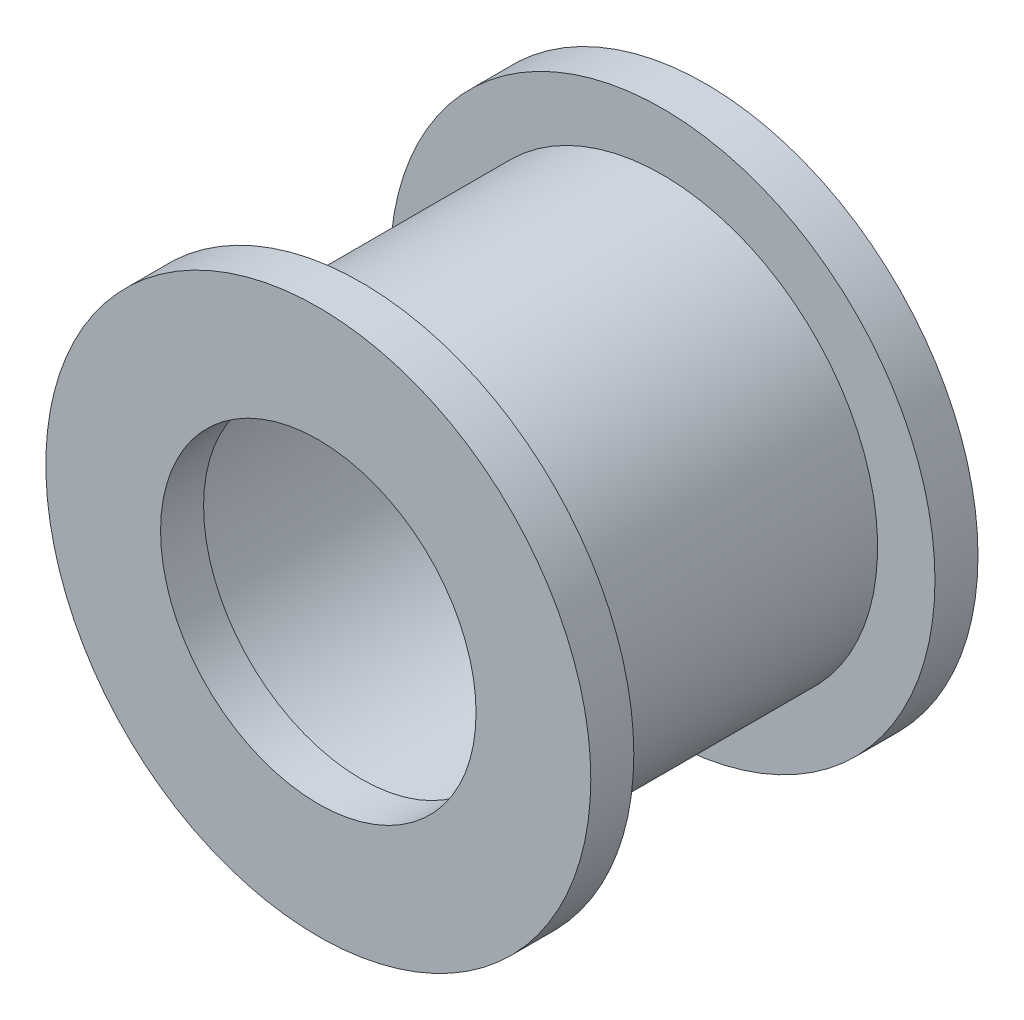
from build123d import *

# Parameters (mm, degrees)
ESQUISSE1_R        = 9.5
ESQUISSE1_R_2      = 6.45
ESQUISSE1_R_3      = 5.5
BOSS_EXTRU_1_DEPTH = 1.5
ESQUISSE1_3_R      = 6.45
ESQUISSE1_3_R_2    = 5.5
BOSS_EXTRU_4_DEPTH = 1.5
ESQUISSE6_R        = 7.5
ESQUISSE6_R_2      = 6.5
BOSS_EXTRU_5_DEPTH = 10.5
ESQUISSE7_R        = 9.5
ESQUISSE7_R_2      = 7.5
ESQUISSE7_R_3      = 6.5
ESQUISSE7_R_4      = 5.5
BOSS_EXTRU_6_DEPTH = 1.5


with BuildPart() as part:
    # Esquisse1 → Boss.-Extru.1 (new body)
    # profile 1 of 2: a face of its own
    with BuildSketch(Plane.XY):
        Circle(ESQUISSE1_R)
        Circle(ESQUISSE1_R_2, mode=Mode.SUBTRACT)
    # profile 2 of 2: a face of its own
    with BuildSketch(Plane.XY):
        Circle(ESQUISSE1_R_2)
        Circle(ESQUISSE1_R_3, mode=Mode.SUBTRACT)
    extrude(amount=BOSS_EXTRU_1_DEPTH)

    # Esquisse1<3> → Boss.-Extru.4 (add)
    with BuildSketch(Plane.XY):
        Circle(ESQUISSE1_3_R)
        Circle(ESQUISSE1_3_R_2, mode=Mode.SUBTRACT)
    extrude(amount=BOSS_EXTRU_4_DEPTH)

    # Esquisse6 → Boss.-Extru.5 (add)
    with BuildSketch(Plane.XY.offset(1.5)):
        with Locations(Location((0, 0, 0), (0, 0, 180))):
            Circle(ESQUISSE6_R)
        with Locations(Location((0, 0, 0), (0, 0, 180))):
            Circle(ESQUISSE6_R_2, mode=Mode.SUBTRACT)
    extrude(amount=BOSS_EXTRU_5_DEPTH)

    # Esquisse7 → Boss.-Extru.6 (add)
    # profile 1 of 3: a face of its own
    with BuildSketch(Plane.XY.offset(12)):
        Circle(ESQUISSE7_R)
        with Locations(Location((0, 0, 0), (0, 0, 180))):
            Circle(ESQUISSE7_R_2, mode=Mode.SUBTRACT)
    # profile 2 of 3: a face of its own
    with BuildSketch(Plane.XY.offset(12)):
        with Locations(Location((0, 0, 0), (0, 0, 180))):
            Circle(ESQUISSE7_R_2)
        with Locations(Location((0, 0, 0), (0, 0, 180))):
            Circle(ESQUISSE7_R_3, mode=Mode.SUBTRACT)
    # profile 3 of 3: a face of its own
    with BuildSketch(Plane.XY.offset(12)):
        with Locations(Location((0, 0, 0), (0, 0, 180))):
            Circle(ESQUISSE7_R_3)
        Circle(ESQUISSE7_R_4, mode=Mode.SUBTRACT)
    extrude(amount=BOSS_EXTRU_6_DEPTH)


solid = part.part
